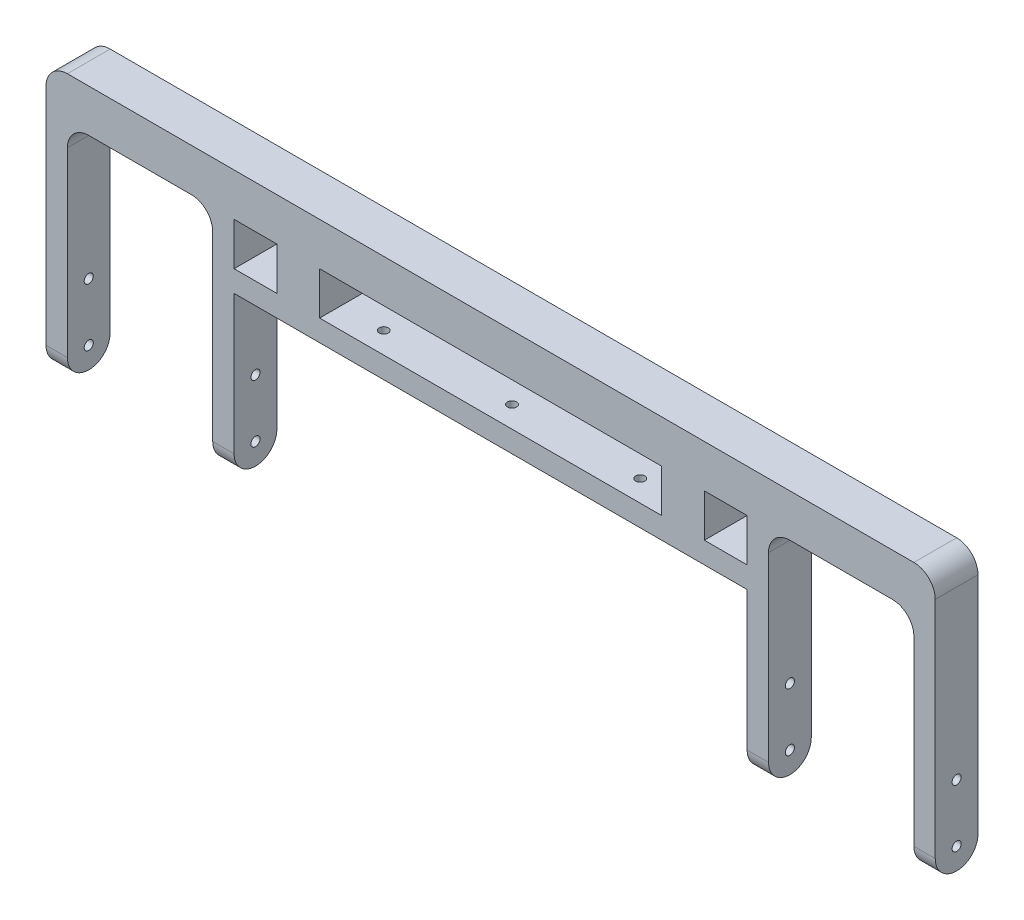
from build123d import *

# Parameters (mm, degrees)
SKETCH2_W           = 240
SKETCH2_H           = 10
BOSS_EXTRUDE1_DEPTH = 20
SKETCH3_R           = 2.125
CUT_EXTRUDE1_DEPTH  = 20
SKETCH4_W           = 20
SKETCH4_H           = 20
BOSS_EXTRUDE2_DEPTH = 20
SKETCH5_W           = 416
SKETCH5_H           = 20
BOSS_EXTRUDE3_DEPTH = 20
SKETCH6_W           = 10
SKETCH6_H           = 20
BOSS_EXTRUDE4_DEPTH = 95
BOSS_EXTRUDE5_REACH = 423.522
SKETCH8_W           = 68
SKETCH8_H           = 10
SKETCH8_W_2         = 240
CUT_EXTRUDE2_DEPTH  = 65
CUT_EXTRUDE3_REACH  = 425.18
SKETCH9_R           = 2.125
FILLET1_R           = 10
CUT_EXTRUDE4_REACH  = 425.18
SKETCH10_R          = 2.125


with BuildPart() as part:
    # Sketch2 → Boss-Extrude1 (new body)
    with BuildSketch(Plane.XY):
        with Locations((120, 5)):
            Rectangle(SKETCH2_W, SKETCH2_H)
    extrude(amount=BOSS_EXTRUDE1_DEPTH)

    # Sketch3 → Cut-Extrude1 (cut)
    with BuildSketch(Plane(origin=(0, 10, 0), x_dir=(1, 0, 0), z_dir=(0, 1, 0))):
        with Locations(Location((60, -10, 0), (0, 0, 270))):
            Circle(SKETCH3_R)
        with Locations(Location((120, -10, 0), (0, 0, 270))):
            Circle(SKETCH3_R)
        with Locations(Location((180, -10, 0), (0, 0, 270))):
            Circle(SKETCH3_R)
    extrude(amount=-CUT_EXTRUDE1_DEPTH, mode=Mode.SUBTRACT)

    # Sketch4 → Boss-Extrude2 (add)
    with BuildSketch(Plane(origin=(0, 10, 0), x_dir=(1, 0, 0), z_dir=(0, 1, 0))):
        with Locations((30, -10)):
            Rectangle(SKETCH4_W, SKETCH4_H)
        with Locations((210, -10)):
            Rectangle(SKETCH4_W, SKETCH4_H)
    extrude(amount=BOSS_EXTRUDE2_DEPTH)

    # Sketch5 → Boss-Extrude3 (add)
    with BuildSketch(Plane(origin=(0, 30, 0), x_dir=(1, 0, 0), z_dir=(0, 1, 0))):
        with Locations((120, -10)):
            Rectangle(SKETCH5_W, SKETCH5_H)
    extrude(amount=BOSS_EXTRUDE3_DEPTH)

    # Sketch6 → Boss-Extrude4 (add)
    with BuildSketch(Plane.XZ.offset(-30)):
        with Locations((245, 10)):
            Rectangle(SKETCH6_W, SKETCH6_H)
        with Locations((-5, 10)):
            Rectangle(SKETCH6_W, SKETCH6_H)
        with Locations((323, 10)):
            Rectangle(SKETCH6_W, SKETCH6_H)
        with Locations((-83, 10)):
            Rectangle(SKETCH6_W, SKETCH6_H)
    extrude(amount=BOSS_EXTRUDE4_DEPTH)

    # Boss-Extrude5: up to this face of the body (flat: up to its plane)
    boss_extrude5_end = Plane(part.part.faces().sort_by_distance((328, -7.5, 10))[0])
    # Sketch7 → Boss-Extrude5 (add, up to the picked face)
    with BuildSketch(Plane.ZY.offset(88), mode=Mode.PRIVATE) as boss_extrude5_sk1:
        with BuildLine():
            Line((0, -65), (20, -65))
            ThreePointArc((20, -65), (10, -75), (0, -65))
        make_face()
    boss_extrude5_tool1 = split(extrude(boss_extrude5_sk1.sketch, amount=-BOSS_EXTRUDE5_REACH, mode=Mode.PRIVATE), bisect_by=boss_extrude5_end, keep=Keep.BOTH, mode=Mode.PRIVATE)
    add(boss_extrude5_tool1.solids().sort_by(Axis((-88, -69.244132, 10), (1, 0, 0)))[0])

    # Sketch8 → Cut-Extrude2 (cut)
    with BuildSketch(Plane(origin=(0, 0, 0), x_dir=(-1, 0, 0), z_dir=(0, 0, -1))):
        with Locations((-284, -70)):
            Rectangle(SKETCH8_W, SKETCH8_H)
        with Locations((-120, -70)):
            Rectangle(SKETCH8_W_2, SKETCH8_H)
        with Locations((44, -70)):
            Rectangle(SKETCH8_W, SKETCH8_H)
    extrude(amount=-CUT_EXTRUDE2_DEPTH, mode=Mode.SUBTRACT)

    # Cut-Extrude3: up to this face of the body (flat: up to its plane)
    cut_extrude3_end = Plane(part.part.faces().sort_by_distance((328, -11.447265452, 10))[0])
    # Sketch9 → Cut-Extrude3 (cut, up to the picked face)
    with BuildSketch(Plane.ZY.offset(88), mode=Mode.PRIVATE) as cut_extrude3_sk1:
        with Locations((10, -38)):
            Circle(SKETCH9_R)
    cut_extrude3_tool1 = split(extrude(cut_extrude3_sk1.sketch, amount=-CUT_EXTRUDE3_REACH, mode=Mode.PRIVATE), bisect_by=cut_extrude3_end, keep=Keep.BOTH, mode=Mode.PRIVATE)
    add(cut_extrude3_tool1.solids().sort_by(Axis((-88, -38, 10), (1, 0, 0)))[0], mode=Mode.SUBTRACT)

    # Fillet1
    fillet1_edges = [part.edges().sort_by_distance(p)[0] for p in [
        (318, 30, 10),
        (-78, 30, 10),
        (-88, 50, 10),
        (328, 50, 10),
        (250, 30, 10),
        (-10, 30, 10),
    ]]
    fillet(fillet1_edges, radius=FILLET1_R)

    # Cut-Extrude4: up to this face of the body (flat: up to its plane)
    cut_extrude4_end = Plane(part.part.faces().sort_by_distance((-88, -16.31275275, 10))[0])
    # Sketch10 → Cut-Extrude4 (cut, up to the picked face)
    with BuildSketch(Plane(origin=(328, 0, 0), x_dir=(0, 0, -1), z_dir=(1, 0, 0)), mode=Mode.PRIVATE) as cut_extrude4_sk1:
        with Locations((-10, -65)):
            Circle(SKETCH10_R)
    cut_extrude4_tool1 = split(extrude(cut_extrude4_sk1.sketch, amount=-CUT_EXTRUDE4_REACH, mode=Mode.PRIVATE), bisect_by=cut_extrude4_end, keep=Keep.BOTH, mode=Mode.PRIVATE)
    add(cut_extrude4_tool1.solids().sort_by(Axis((328, -65, 10), (-1, 0, 0)))[0], mode=Mode.SUBTRACT)


solid = part.part
